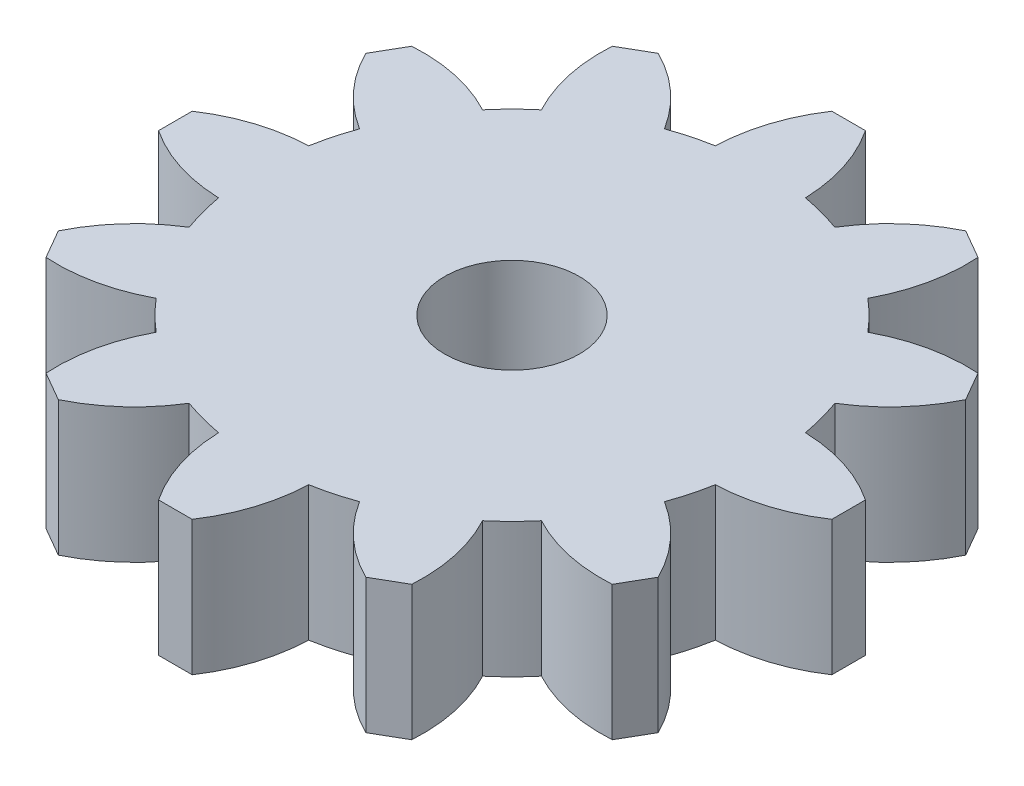
from build123d import *

# Parameters (mm, degrees)
SKETCH1_R           = 4
BOSS_EXTRUDE1_DEPTH = 4


with BuildPart() as part:
    # Sketch1 → Boss-Extrude1 (new, symmetric)
    with BuildSketch(Plane(origin=(0, 0, 0), x_dir=(1, 0, 0), z_dir=(0, 1, 0))):
        with BuildLine():
            Line((-1, 20), (1, 20))
            ThreePointArc((1, 20), (2.204975942, 17.497232023), (2.675, 14.759551992))
            ThreePointArc((2.675, 14.759551992), (3.882285677, 14.488887394), (5.063158041, 14.119646973))
            ThreePointArc((5.063158041, 14.119646973), (6.839050831, 16.255535399), (9.133974596, 17.820508076))
            Line((9.133974596, 17.820508076), (10.866025404, 16.820508076))
            ThreePointArc((10.866025404, 16.820508076), (10.658181192, 14.050559457), (9.696393951, 11.444646973))
            ThreePointArc((9.696393951, 11.444646973), (10.606601718, 10.606601718), (11.444646973, 9.696393951))
            ThreePointArc((11.444646973, 9.696393951), (14.050559457, 10.658181192), (16.820508076, 10.866025404))
            Line((16.820508076, 10.866025404), (17.820508076, 9.133974596))
            ThreePointArc((17.820508076, 9.133974596), (16.255535399, 6.839050831), (14.119646973, 5.063158041))
            ThreePointArc((14.119646973, 5.063158041), (14.488887394, 3.882285677), (14.759551992, 2.675))
            ThreePointArc((14.759551992, 2.675), (17.497232023, 2.204975942), (20, 1))
            Line((20, 1), (20, -1))
            ThreePointArc((20, -1), (17.497232023, -2.204975942), (14.759551992, -2.675))
            ThreePointArc((14.759551992, -2.675), (14.488887394, -3.882285677), (14.119646973, -5.063158041))
            ThreePointArc((14.119646973, -5.063158041), (16.255535399, -6.839050831), (17.820508076, -9.133974596))
            Line((17.820508076, -9.133974596), (16.820508076, -10.866025404))
            ThreePointArc((16.820508076, -10.866025404), (14.050559457, -10.658181192), (11.444646973, -9.696393951))
            ThreePointArc((11.444646973, -9.696393951), (10.606601718, -10.606601718), (9.696393951, -11.444646973))
            ThreePointArc((9.696393951, -11.444646973), (10.658181192, -14.050559457), (10.866025404, -16.820508076))
            Line((10.866025404, -16.820508076), (9.133974596, -17.820508076))
            ThreePointArc((9.133974596, -17.820508076), (6.839050831, -16.255535399), (5.063158041, -14.119646973))
            ThreePointArc((5.063158041, -14.119646973), (3.882285677, -14.488887394), (2.675, -14.759551992))
            ThreePointArc((2.675, -14.759551992), (2.204975942, -17.497232023), (1, -20))
            Line((1, -20), (-1, -20))
            ThreePointArc((-1, -20), (-2.204975942, -17.497232023), (-2.675, -14.759551992))
            ThreePointArc((-2.675, -14.759551992), (-3.882285677, -14.488887394), (-5.063158041, -14.119646973))
            ThreePointArc((-5.063158041, -14.119646973), (-6.839050831, -16.255535399), (-9.133974596, -17.820508076))
            Line((-9.133974596, -17.820508076), (-10.866025404, -16.820508076))
            ThreePointArc((-10.866025404, -16.820508076), (-10.658181192, -14.050559457), (-9.696393951, -11.444646973))
            ThreePointArc((-9.696393951, -11.444646973), (-10.606601718, -10.606601718), (-11.444646973, -9.696393951))
            ThreePointArc((-11.444646973, -9.696393951), (-14.050559457, -10.658181192), (-16.820508076, -10.866025404))
            Line((-16.820508076, -10.866025404), (-17.820508076, -9.133974596))
            ThreePointArc((-17.820508076, -9.133974596), (-16.255535399, -6.839050831), (-14.119646973, -5.063158041))
            ThreePointArc((-14.119646973, -5.063158041), (-14.488887394, -3.882285677), (-14.759551992, -2.675))
            ThreePointArc((-14.759551992, -2.675), (-17.497232023, -2.204975942), (-20, -1))
            Line((-20, -1), (-20, 1))
            ThreePointArc((-20, 1), (-17.497232023, 2.204975942), (-14.759551992, 2.675))
            ThreePointArc((-14.759551992, 2.675), (-14.488887394, 3.882285677), (-14.119646973, 5.063158041))
            ThreePointArc((-14.119646973, 5.063158041), (-16.255535399, 6.839050831), (-17.820508076, 9.133974596))
            Line((-17.820508076, 9.133974596), (-16.820508076, 10.866025404))
            ThreePointArc((-16.820508076, 10.866025404), (-14.050559457, 10.658181192), (-11.444646973, 9.696393951))
            ThreePointArc((-11.444646973, 9.696393951), (-10.606601718, 10.606601718), (-9.696393951, 11.444646973))
            ThreePointArc((-9.696393951, 11.444646973), (-10.658181192, 14.050559457), (-10.866025404, 16.820508076))
            Line((-10.866025404, 16.820508076), (-9.133974596, 17.820508076))
            ThreePointArc((-9.133974596, 17.820508076), (-6.839050831, 16.255535399), (-5.063158041, 14.119646973))
            ThreePointArc((-5.063158041, 14.119646973), (-3.882285677, 14.488887394), (-2.675, 14.759551992))
            ThreePointArc((-2.675, 14.759551992), (-2.204975942, 17.497232023), (-1, 20))
        make_face()
        with Locations(Location((0, 0, 0), (0, 0, 270))):
            Circle(SKETCH1_R, mode=Mode.SUBTRACT)
    extrude(amount=BOSS_EXTRUDE1_DEPTH, both=True)


solid = part.part
